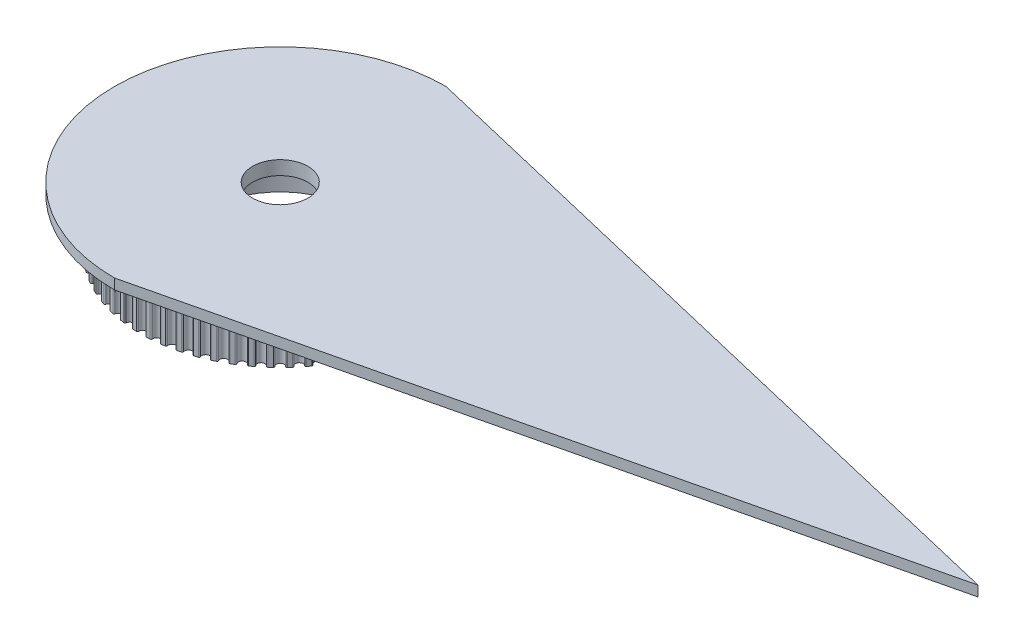
from build123d import *

# Parameters (mm, degrees)
BOSS_EXTRUDE1_DEPTH = 1.5
SKETCH2_R           = 11
BOSS_EXTRUDE3_DEPTH = 7.5
SKETCH3_R           = 6
SKETCH3_R_2         = 4
BOSS_EXTRUDE4_DEPTH = 0.5
SKETCH4_R           = 4
CUT_EXTRUDE1_DEPTH  = 105.082899652


with BuildPart() as part:
    # Sketch1 → Boss-Extrude1 (new body)
    with BuildSketch(Plane(origin=(0, 0, 0), x_dir=(1, 0, 0), z_dir=(0, 1, 0))):
        with BuildLine():
            Line((0, 24), (101, 0))
            Line((101, 0), (0, -24))
            ThreePointArc((0, -24), (-24, 0), (0, 24))
        make_face()
    extrude(amount=BOSS_EXTRUDE1_DEPTH)

    # Sketch2 → Boss-Extrude3 (add)
    with BuildSketch(Plane.XZ):
        with BuildLine():
            ThreePointArc((0, 19.37), (0.40140939, 19.54173051), (0.554407106, 19.950646841))
            ThreePointArc((0.554407106, 19.950646841), (0.597601495, 20.063061902), (0.709536651, 20.107485117))
            ThreePointArc((0.709536651, 20.107485117), (0.987241607, 20.095764579), (1.264758152, 20.080208834))
            ThreePointArc((1.264758152, 20.080208834), (1.371800073, 20.025027964), (1.403767866, 19.908920422))
            ThreePointArc((1.403767866, 19.908920422), (1.515948048, 19.486976737), (1.898592008, 19.276728156))
            ThreePointArc((1.898592008, 19.276728156), (2.314901036, 19.408286736), (2.507242836, 19.800237624))
            ThreePointArc((2.507242836, 19.800237624), (2.561247834, 19.907877585), (2.676998228, 19.941115327))
            ThreePointArc((2.676998228, 19.941115327), (2.952217146, 19.90223138), (3.226872643, 19.859549163))
            ThreePointArc((3.226872643, 19.859549163), (3.327990457, 19.794142061), (3.348423787, 19.675460217))
            ThreePointArc((3.348423787, 19.675460217), (3.418706077, 19.244552725), (3.778899537, 18.997810881))
            ThreePointArc((3.778899537, 18.997810881), (4.206098919, 19.087930551), (4.435932446, 19.459141295))
            ThreePointArc((4.435932446, 19.459141295), (4.500227957, 19.560969525), (4.61867885, 19.582701695))
            ThreePointArc((4.61867885, 19.582701695), (4.88876122, 19.517028814), (5.157910587, 19.447631177))
            ThreePointArc((5.157910587, 19.447631177), (5.252130474, 19.372627749), (5.260832557, 19.252514574))
            ThreePointArc((5.260832557, 19.252514574), (5.288540098, 18.81679315), (5.622814198, 18.535934303))
            ThreePointArc((5.622814198, 18.535934303), (6.05678977, 18.58374716), (6.321901602, 18.930642798))
            ThreePointArc((6.321901602, 18.930642798), (6.395868424, 19.025678635), (6.515879069, 19.035695941))
            ThreePointArc((6.515879069, 19.035695941), (6.77822385, 18.943866591), (7.039275031, 18.848421871))
            ThreePointArc((7.039275031, 18.848421871), (7.125689602, 18.764544442), (7.122576633, 18.644156691))
            ThreePointArc((7.122576633, 18.644156691), (7.107442587, 18.207817571), (7.412578085, 17.895546545))
            ThreePointArc((7.412578085, 17.895546545), (7.849150425, 17.900592125), (8.146987389, 18.219831862))
            ThreePointArc((8.146987389, 18.219831862), (8.229913182, 18.307160059), (8.35032781, 18.305366029))
            ThreePointArc((8.35032781, 18.305366029), (8.60240848, 18.188264578), (8.85284741, 18.067691959))
            ThreePointArc((8.85284741, 18.067691959), (8.930624445, 17.975748314), (8.915726402, 17.856245387))
            ThreePointArc((8.915726402, 17.856245387), (8.857896518, 17.423490756), (9.130954792, 17.08281489))
            ThreePointArc((9.130954792, 17.08281489), (9.565919471, 17.045044603), (9.893613234, 17.333553985))
            ThreePointArc((9.893613234, 17.333553985), (9.984699377, 17.412333524), (10.10435833, 17.398745436))
            ThreePointArc((10.10435833, 17.398745436), (10.343747213, 17.257499633), (10.581162028, 17.112960297))
            ThreePointArc((10.581162028, 17.112960297), (10.649552492, 17.013835903), (10.623012852, 16.896368679))
            ThreePointArc((10.623012852, 16.896368679), (10.523044063, 16.471366199), (10.761395414, 16.10556639))
            ThreePointArc((10.761395414, 16.10556639), (11.190563483, 16.025343983), (11.544958176, 16.280344508))
            ThreePointArc((11.544958176, 16.280344508), (11.643327459, 16.349816699), (11.761078356, 16.324565412))
            ThreePointArc((11.761078356, 16.324565412), (11.985470006, 16.160535533), (12.207574272, 15.993421473))
            ThreePointArc((12.207574272, 15.993421473), (12.265919528, 15.888070952), (12.227993882, 15.773770704))
            ThreePointArc((12.227993882, 15.773770704), (12.086848942, 15.360613382), (12.288197914, 14.973212482))
            ThreePointArc((12.288197914, 14.973212482), (12.707436251, 14.85131054), (13.085118859, 15.070346414))
            ThreePointArc((13.085118859, 15.070346414), (13.189823933, 15.129842201), (13.304532768, 15.0931709))
            ThreePointArc((13.304532768, 15.0931709), (13.511766172, 14.907936642), (13.716420902, 14.719857256))
            ThreePointArc((13.716420902, 14.719857256), (13.764159052, 14.609295192), (13.715212646, 14.499262694))
            ThreePointArc((13.715212646, 14.499262694), (13.534250858, 14.101929462), (13.696658352, 13.696658352))
            ThreePointArc((13.696658352, 13.696658352), (14.101929462, 13.534250858), (14.499262694, 13.715212646))
            ThreePointArc((14.499262694, 13.715212646), (14.609295192, 13.764159052), (14.719857256, 13.716420902))
            ThreePointArc((14.719857256, 13.716420902), (14.907936642, 13.511766172), (15.0931709, 13.304532768))
            ThreePointArc((15.0931709, 13.304532768), (15.129842201, 13.189823933), (15.070346414, 13.085118859))
            ThreePointArc((15.070346414, 13.085118859), (14.85131054, 12.707436251), (14.973212482, 12.288197914))
            ThreePointArc((14.973212482, 12.288197914), (15.360613382, 12.086848942), (15.773770704, 12.227993882))
            ThreePointArc((15.773770704, 12.227993882), (15.888070952, 12.265919528), (15.993421473, 12.207574272))
            ThreePointArc((15.993421473, 12.207574272), (16.160535533, 11.985470006), (16.324565412, 11.761078356))
            ThreePointArc((16.324565412, 11.761078356), (16.349816699, 11.643327459), (16.280344508, 11.544958176))
            ThreePointArc((16.280344508, 11.544958176), (16.025343983, 11.190563483), (16.10556639, 10.761395414))
            ThreePointArc((16.10556639, 10.761395414), (16.471366199, 10.523044063), (16.896368679, 10.623012852))
            ThreePointArc((16.896368679, 10.623012852), (17.013835903, 10.649552492), (17.112960297, 10.581162028))
            ThreePointArc((17.112960297, 10.581162028), (17.257499633, 10.343747213), (17.398745436, 10.10435833))
            ThreePointArc((17.398745436, 10.10435833), (17.412333524, 9.984699377), (17.333553985, 9.893613234))
            ThreePointArc((17.333553985, 9.893613234), (17.045044603, 9.565919471), (17.08281489, 9.130954792))
            ThreePointArc((17.08281489, 9.130954792), (17.423490756, 8.857896518), (17.856245387, 8.915726402))
            ThreePointArc((17.856245387, 8.915726402), (17.975748314, 8.930624445), (18.067691959, 8.85284741))
            ThreePointArc((18.067691959, 8.85284741), (18.188264578, 8.60240848), (18.305366029, 8.35032781))
            ThreePointArc((18.305366029, 8.35032781), (18.307160059, 8.229913182), (18.219831862, 8.146987389))
            ThreePointArc((18.219831862, 8.146987389), (17.900592125, 7.849150425), (17.895546545, 7.412578085))
            ThreePointArc((17.895546545, 7.412578085), (18.207817571, 7.107442587), (18.644156691, 7.122576633))
            ThreePointArc((18.644156691, 7.122576633), (18.764544442, 7.125689602), (18.848421871, 7.039275031))
            ThreePointArc((18.848421871, 7.039275031), (18.943866591, 6.77822385), (19.035695941, 6.515879069))
            ThreePointArc((19.035695941, 6.515879069), (19.025678635, 6.395868424), (18.930642798, 6.321901602))
            ThreePointArc((18.930642798, 6.321901602), (18.58374716, 6.05678977), (18.535934303, 5.622814198))
            ThreePointArc((18.535934303, 5.622814198), (18.81679315, 5.288540098), (19.252514574, 5.260832557))
            ThreePointArc((19.252514574, 5.260832557), (19.372627749, 5.252130474), (19.447631177, 5.157910587))
            ThreePointArc((19.447631177, 5.157910587), (19.517028814, 4.88876122), (19.582701695, 4.61867885))
            ThreePointArc((19.582701695, 4.61867885), (19.560969525, 4.500227957), (19.459141295, 4.435932446))
            ThreePointArc((19.459141295, 4.435932446), (19.087930551, 4.206098919), (18.997810881, 3.778899537))
            ThreePointArc((18.997810881, 3.778899537), (19.244552725, 3.418706077), (19.675460217, 3.348423787))
            ThreePointArc((19.675460217, 3.348423787), (19.794142061, 3.327990457), (19.859549163, 3.226872643))
            ThreePointArc((19.859549163, 3.226872643), (19.90223138, 2.952217146), (19.941115327, 2.676998228))
            ThreePointArc((19.941115327, 2.676998228), (19.907877585, 2.561247834), (19.800237624, 2.507242836))
            ThreePointArc((19.800237624, 2.507242836), (19.408286736, 2.314901036), (19.276728156, 1.898592008))
            ThreePointArc((19.276728156, 1.898592008), (19.486976737, 1.515948048), (19.908920422, 1.403767866))
            ThreePointArc((19.908920422, 1.403767866), (20.025027964, 1.371800073), (20.080208834, 1.264758152))
            ThreePointArc((20.080208834, 1.264758152), (20.095764579, 0.987241607), (20.107485117, 0.709536651))
            ThreePointArc((20.107485117, 0.709536651), (20.063061902, 0.597601495), (19.950646841, 0.554407106))
            ThreePointArc((19.950646841, 0.554407106), (19.54173051, 0.40140939), (19.37, 0))
            ThreePointArc((19.37, 0), (19.54173051, -0.40140939), (19.950646841, -0.554407106))
            ThreePointArc((19.950646841, -0.554407106), (20.063061902, -0.597601495), (20.107485117, -0.709536651))
            ThreePointArc((20.107485117, -0.709536651), (20.095764579, -0.987241607), (20.080208834, -1.264758152))
            ThreePointArc((20.080208834, -1.264758152), (20.025027964, -1.371800073), (19.908920422, -1.403767866))
            ThreePointArc((19.908920422, -1.403767866), (19.486976737, -1.515948048), (19.276728156, -1.898592008))
            ThreePointArc((19.276728156, -1.898592008), (19.408286736, -2.314901036), (19.800237624, -2.507242836))
            ThreePointArc((19.800237624, -2.507242836), (19.907877585, -2.561247834), (19.941115327, -2.676998228))
            ThreePointArc((19.941115327, -2.676998228), (19.90223138, -2.952217146), (19.859549163, -3.226872643))
            ThreePointArc((19.859549163, -3.226872643), (19.794142061, -3.327990457), (19.675460217, -3.348423787))
            ThreePointArc((19.675460217, -3.348423787), (19.244552725, -3.418706077), (18.997810881, -3.778899537))
            ThreePointArc((18.997810881, -3.778899537), (19.087930551, -4.206098919), (19.459141295, -4.435932446))
            ThreePointArc((19.459141295, -4.435932446), (19.560969525, -4.500227957), (19.582701695, -4.61867885))
            ThreePointArc((19.582701695, -4.61867885), (19.517028814, -4.88876122), (19.447631177, -5.157910587))
            ThreePointArc((19.447631177, -5.157910587), (19.372627749, -5.252130474), (19.252514574, -5.260832557))
            ThreePointArc((19.252514574, -5.260832557), (18.81679315, -5.288540098), (18.535934303, -5.622814198))
            ThreePointArc((18.535934303, -5.622814198), (18.58374716, -6.05678977), (18.930642798, -6.321901602))
            ThreePointArc((18.930642798, -6.321901602), (19.025678635, -6.395868424), (19.035695941, -6.515879069))
            ThreePointArc((19.035695941, -6.515879069), (18.943866591, -6.77822385), (18.848421871, -7.039275031))
            ThreePointArc((18.848421871, -7.039275031), (18.764544442, -7.125689602), (18.644156691, -7.122576633))
            ThreePointArc((18.644156691, -7.122576633), (18.207817571, -7.107442587), (17.895546545, -7.412578085))
            ThreePointArc((17.895546545, -7.412578085), (17.900592125, -7.849150425), (18.219831862, -8.146987389))
            ThreePointArc((18.219831862, -8.146987389), (18.307160059, -8.229913182), (18.305366029, -8.35032781))
            ThreePointArc((18.305366029, -8.35032781), (18.188264578, -8.60240848), (18.067691959, -8.85284741))
            ThreePointArc((18.067691959, -8.85284741), (17.975748314, -8.930624445), (17.856245387, -8.915726402))
            ThreePointArc((17.856245387, -8.915726402), (17.423490756, -8.857896518), (17.08281489, -9.130954792))
            ThreePointArc((17.08281489, -9.130954792), (17.045044603, -9.565919471), (17.333553985, -9.893613234))
            ThreePointArc((17.333553985, -9.893613234), (17.412333524, -9.984699377), (17.398745436, -10.10435833))
            ThreePointArc((17.398745436, -10.10435833), (17.257499633, -10.343747213), (17.112960297, -10.581162028))
            ThreePointArc((17.112960297, -10.581162028), (17.013835903, -10.649552492), (16.896368679, -10.623012852))
            ThreePointArc((16.896368679, -10.623012852), (16.471366199, -10.523044063), (16.10556639, -10.761395414))
            ThreePointArc((16.10556639, -10.761395414), (16.025343983, -11.190563483), (16.280344508, -11.544958176))
            ThreePointArc((16.280344508, -11.544958176), (16.349816699, -11.643327459), (16.324565412, -11.761078356))
            ThreePointArc((16.324565412, -11.761078356), (16.160535533, -11.985470006), (15.993421473, -12.207574272))
            ThreePointArc((15.993421473, -12.207574272), (15.888070952, -12.265919528), (15.773770704, -12.227993882))
            ThreePointArc((15.773770704, -12.227993882), (15.360613382, -12.086848942), (14.973212482, -12.288197914))
            ThreePointArc((14.973212482, -12.288197914), (14.85131054, -12.707436251), (15.070346414, -13.085118859))
            ThreePointArc((15.070346414, -13.085118859), (15.129842201, -13.189823933), (15.0931709, -13.304532768))
            ThreePointArc((15.0931709, -13.304532768), (14.907936642, -13.511766172), (14.719857256, -13.716420902))
            ThreePointArc((14.719857256, -13.716420902), (14.609295192, -13.764159052), (14.499262694, -13.715212646))
            ThreePointArc((14.499262694, -13.715212646), (14.101929462, -13.534250858), (13.696658352, -13.696658352))
            ThreePointArc((13.696658352, -13.696658352), (13.534250858, -14.101929462), (13.715212646, -14.499262694))
            ThreePointArc((13.715212646, -14.499262694), (13.764159052, -14.609295192), (13.716420902, -14.719857256))
            ThreePointArc((13.716420902, -14.719857256), (13.511766172, -14.907936642), (13.304532768, -15.0931709))
            ThreePointArc((13.304532768, -15.0931709), (13.189823933, -15.129842201), (13.085118859, -15.070346414))
            ThreePointArc((13.085118859, -15.070346414), (12.707436251, -14.85131054), (12.288197914, -14.973212482))
            ThreePointArc((12.288197914, -14.973212482), (12.086848942, -15.360613382), (12.227993882, -15.773770704))
            ThreePointArc((12.227993882, -15.773770704), (12.265919528, -15.888070952), (12.207574272, -15.993421473))
            ThreePointArc((12.207574272, -15.993421473), (11.985470006, -16.160535533), (11.761078356, -16.324565412))
            ThreePointArc((11.761078356, -16.324565412), (11.643327459, -16.349816699), (11.544958176, -16.280344508))
            ThreePointArc((11.544958176, -16.280344508), (11.190563483, -16.025343983), (10.761395414, -16.10556639))
            ThreePointArc((10.761395414, -16.10556639), (10.523044063, -16.471366199), (10.623012852, -16.896368679))
            ThreePointArc((10.623012852, -16.896368679), (10.649552492, -17.013835903), (10.581162028, -17.112960297))
            ThreePointArc((10.581162028, -17.112960297), (10.343747213, -17.257499633), (10.10435833, -17.398745436))
            ThreePointArc((10.10435833, -17.398745436), (9.984699377, -17.412333524), (9.893613234, -17.333553985))
            ThreePointArc((9.893613234, -17.333553985), (9.565919471, -17.045044603), (9.130954792, -17.08281489))
            ThreePointArc((9.130954792, -17.08281489), (8.857896518, -17.423490756), (8.915726402, -17.856245387))
            ThreePointArc((8.915726402, -17.856245387), (8.930624445, -17.975748314), (8.85284741, -18.067691959))
            ThreePointArc((8.85284741, -18.067691959), (8.60240848, -18.188264578), (8.35032781, -18.305366029))
            ThreePointArc((8.35032781, -18.305366029), (8.229913182, -18.307160059), (8.146987389, -18.219831862))
            ThreePointArc((8.146987389, -18.219831862), (7.849150425, -17.900592125), (7.412578085, -17.895546545))
            ThreePointArc((7.412578085, -17.895546545), (7.107442587, -18.207817571), (7.122576633, -18.644156691))
            ThreePointArc((7.122576633, -18.644156691), (7.125689602, -18.764544442), (7.039275031, -18.848421871))
            ThreePointArc((7.039275031, -18.848421871), (6.77822385, -18.943866591), (6.515879069, -19.035695941))
            ThreePointArc((6.515879069, -19.035695941), (6.395868424, -19.025678635), (6.321901602, -18.930642798))
            ThreePointArc((6.321901602, -18.930642798), (6.05678977, -18.58374716), (5.622814198, -18.535934303))
            ThreePointArc((5.622814198, -18.535934303), (5.288540098, -18.81679315), (5.260832557, -19.252514574))
            ThreePointArc((5.260832557, -19.252514574), (5.252130474, -19.372627749), (5.157910587, -19.447631177))
            ThreePointArc((5.157910587, -19.447631177), (4.88876122, -19.517028814), (4.61867885, -19.582701695))
            ThreePointArc((4.61867885, -19.582701695), (4.500227957, -19.560969525), (4.435932446, -19.459141295))
            ThreePointArc((4.435932446, -19.459141295), (4.206098919, -19.087930551), (3.778899537, -18.997810881))
            ThreePointArc((3.778899537, -18.997810881), (3.418706077, -19.244552725), (3.348423787, -19.675460217))
            ThreePointArc((3.348423787, -19.675460217), (3.327990457, -19.794142061), (3.226872643, -19.859549163))
            ThreePointArc((3.226872643, -19.859549163), (2.952217146, -19.90223138), (2.676998228, -19.941115327))
            ThreePointArc((2.676998228, -19.941115327), (2.561247834, -19.907877585), (2.507242836, -19.800237624))
            ThreePointArc((2.507242836, -19.800237624), (2.314901036, -19.408286736), (1.898592008, -19.276728156))
            ThreePointArc((1.898592008, -19.276728156), (1.515948048, -19.486976737), (1.403767866, -19.908920422))
            ThreePointArc((1.403767866, -19.908920422), (1.371800073, -20.025027964), (1.264758152, -20.080208834))
            ThreePointArc((1.264758152, -20.080208834), (0.987241607, -20.095764579), (0.709536651, -20.107485117))
            ThreePointArc((0.709536651, -20.107485117), (0.597601495, -20.063061902), (0.554407106, -19.950646841))
            ThreePointArc((0.554407106, -19.950646841), (0.40140939, -19.54173051), (0, -19.37))
            ThreePointArc((0, -19.37), (-0.40140939, -19.54173051), (-0.554407106, -19.950646841))
            ThreePointArc((-0.554407106, -19.950646841), (-0.597601495, -20.063061902), (-0.709536651, -20.107485117))
            ThreePointArc((-0.709536651, -20.107485117), (-0.987241607, -20.095764579), (-1.264758152, -20.080208834))
            ThreePointArc((-1.264758152, -20.080208834), (-1.371800073, -20.025027964), (-1.403767866, -19.908920422))
            ThreePointArc((-1.403767866, -19.908920422), (-1.515948048, -19.486976737), (-1.898592008, -19.276728156))
            ThreePointArc((-1.898592008, -19.276728156), (-2.314901036, -19.408286736), (-2.507242836, -19.800237624))
            ThreePointArc((-2.507242836, -19.800237624), (-2.561247834, -19.907877585), (-2.676998228, -19.941115327))
            ThreePointArc((-2.676998228, -19.941115327), (-2.952217146, -19.90223138), (-3.226872643, -19.859549163))
            ThreePointArc((-3.226872643, -19.859549163), (-3.327990457, -19.794142061), (-3.348423787, -19.675460217))
            ThreePointArc((-3.348423787, -19.675460217), (-3.418706077, -19.244552725), (-3.778899537, -18.997810881))
            ThreePointArc((-3.778899537, -18.997810881), (-4.206098919, -19.087930551), (-4.435932446, -19.459141295))
            ThreePointArc((-4.435932446, -19.459141295), (-4.500227957, -19.560969525), (-4.61867885, -19.582701695))
            ThreePointArc((-4.61867885, -19.582701695), (-4.88876122, -19.517028814), (-5.157910587, -19.447631177))
            ThreePointArc((-5.157910587, -19.447631177), (-5.252130474, -19.372627749), (-5.260832557, -19.252514574))
            ThreePointArc((-5.260832557, -19.252514574), (-5.288540098, -18.81679315), (-5.622814198, -18.535934303))
            ThreePointArc((-5.622814198, -18.535934303), (-6.05678977, -18.58374716), (-6.321901602, -18.930642798))
            ThreePointArc((-6.321901602, -18.930642798), (-6.395868424, -19.025678635), (-6.515879069, -19.035695941))
            ThreePointArc((-6.515879069, -19.035695941), (-6.77822385, -18.943866591), (-7.039275031, -18.848421871))
            ThreePointArc((-7.039275031, -18.848421871), (-7.125689602, -18.764544442), (-7.122576633, -18.644156691))
            ThreePointArc((-7.122576633, -18.644156691), (-7.107442587, -18.207817571), (-7.412578085, -17.895546545))
            ThreePointArc((-7.412578085, -17.895546545), (-7.849150425, -17.900592125), (-8.146987389, -18.219831862))
            ThreePointArc((-8.146987389, -18.219831862), (-8.229913182, -18.307160059), (-8.35032781, -18.305366029))
            ThreePointArc((-8.35032781, -18.305366029), (-8.60240848, -18.188264578), (-8.85284741, -18.067691959))
            ThreePointArc((-8.85284741, -18.067691959), (-8.930624445, -17.975748314), (-8.915726402, -17.856245387))
            ThreePointArc((-8.915726402, -17.856245387), (-8.857896518, -17.423490756), (-9.130954792, -17.08281489))
            ThreePointArc((-9.130954792, -17.08281489), (-9.565919471, -17.045044603), (-9.893613234, -17.333553985))
            ThreePointArc((-9.893613234, -17.333553985), (-9.984699377, -17.412333524), (-10.10435833, -17.398745436))
            ThreePointArc((-10.10435833, -17.398745436), (-10.343747213, -17.257499633), (-10.581162028, -17.112960297))
            ThreePointArc((-10.581162028, -17.112960297), (-10.649552492, -17.013835903), (-10.623012852, -16.896368679))
            ThreePointArc((-10.623012852, -16.896368679), (-10.523044063, -16.471366199), (-10.761395414, -16.10556639))
            ThreePointArc((-10.761395414, -16.10556639), (-11.190563483, -16.025343983), (-11.544958176, -16.280344508))
            ThreePointArc((-11.544958176, -16.280344508), (-11.643327459, -16.349816699), (-11.761078356, -16.324565412))
            ThreePointArc((-11.761078356, -16.324565412), (-11.985470006, -16.160535533), (-12.207574272, -15.993421473))
            ThreePointArc((-12.207574272, -15.993421473), (-12.265919528, -15.888070952), (-12.227993882, -15.773770704))
            ThreePointArc((-12.227993882, -15.773770704), (-12.086848942, -15.360613382), (-12.288197914, -14.973212482))
            ThreePointArc((-12.288197914, -14.973212482), (-12.707436251, -14.85131054), (-13.085118859, -15.070346414))
            ThreePointArc((-13.085118859, -15.070346414), (-13.189823933, -15.129842201), (-13.304532768, -15.0931709))
            ThreePointArc((-13.304532768, -15.0931709), (-13.511766172, -14.907936642), (-13.716420902, -14.719857256))
            ThreePointArc((-13.716420902, -14.719857256), (-13.764159052, -14.609295192), (-13.715212646, -14.499262694))
            ThreePointArc((-13.715212646, -14.499262694), (-13.534250858, -14.101929462), (-13.696658352, -13.696658352))
            ThreePointArc((-13.696658352, -13.696658352), (-14.101929462, -13.534250858), (-14.499262694, -13.715212646))
            ThreePointArc((-14.499262694, -13.715212646), (-14.609295192, -13.764159052), (-14.719857256, -13.716420902))
            ThreePointArc((-14.719857256, -13.716420902), (-14.907936642, -13.511766172), (-15.0931709, -13.304532768))
            ThreePointArc((-15.0931709, -13.304532768), (-15.129842201, -13.189823933), (-15.070346414, -13.085118859))
            ThreePointArc((-15.070346414, -13.085118859), (-14.85131054, -12.707436251), (-14.973212482, -12.288197914))
            ThreePointArc((-14.973212482, -12.288197914), (-15.360613382, -12.086848942), (-15.773770704, -12.227993882))
            ThreePointArc((-15.773770704, -12.227993882), (-15.888070952, -12.265919528), (-15.993421473, -12.207574272))
            ThreePointArc((-15.993421473, -12.207574272), (-16.160535533, -11.985470006), (-16.324565412, -11.761078356))
            ThreePointArc((-16.324565412, -11.761078356), (-16.349816699, -11.643327459), (-16.280344508, -11.544958176))
            ThreePointArc((-16.280344508, -11.544958176), (-16.025343983, -11.190563483), (-16.10556639, -10.761395414))
            ThreePointArc((-16.10556639, -10.761395414), (-16.471366199, -10.523044063), (-16.896368679, -10.623012852))
            ThreePointArc((-16.896368679, -10.623012852), (-17.013835903, -10.649552492), (-17.112960297, -10.581162028))
            ThreePointArc((-17.112960297, -10.581162028), (-17.257499633, -10.343747213), (-17.398745436, -10.10435833))
            ThreePointArc((-17.398745436, -10.10435833), (-17.412333524, -9.984699377), (-17.333553985, -9.893613234))
            ThreePointArc((-17.333553985, -9.893613234), (-17.045044603, -9.565919471), (-17.08281489, -9.130954792))
            ThreePointArc((-17.08281489, -9.130954792), (-17.423490756, -8.857896518), (-17.856245387, -8.915726402))
            ThreePointArc((-17.856245387, -8.915726402), (-17.975748314, -8.930624445), (-18.067691959, -8.85284741))
            ThreePointArc((-18.067691959, -8.85284741), (-18.188264578, -8.60240848), (-18.305366029, -8.35032781))
            ThreePointArc((-18.305366029, -8.35032781), (-18.307160059, -8.229913182), (-18.219831862, -8.146987389))
            ThreePointArc((-18.219831862, -8.146987389), (-17.900592125, -7.849150425), (-17.895546545, -7.412578085))
            ThreePointArc((-17.895546545, -7.412578085), (-18.207817571, -7.107442587), (-18.644156691, -7.122576633))
            ThreePointArc((-18.644156691, -7.122576633), (-18.764544442, -7.125689602), (-18.848421871, -7.039275031))
            ThreePointArc((-18.848421871, -7.039275031), (-18.943866591, -6.77822385), (-19.035695941, -6.515879069))
            ThreePointArc((-19.035695941, -6.515879069), (-19.025678635, -6.395868424), (-18.930642798, -6.321901602))
            ThreePointArc((-18.930642798, -6.321901602), (-18.58374716, -6.05678977), (-18.535934303, -5.622814198))
            ThreePointArc((-18.535934303, -5.622814198), (-18.81679315, -5.288540098), (-19.252514574, -5.260832557))
            ThreePointArc((-19.252514574, -5.260832557), (-19.372627749, -5.252130474), (-19.447631177, -5.157910587))
            ThreePointArc((-19.447631177, -5.157910587), (-19.517028814, -4.88876122), (-19.582701695, -4.61867885))
            ThreePointArc((-19.582701695, -4.61867885), (-19.560969525, -4.500227957), (-19.459141295, -4.435932446))
            ThreePointArc((-19.459141295, -4.435932446), (-19.087930551, -4.206098919), (-18.997810881, -3.778899537))
            ThreePointArc((-18.997810881, -3.778899537), (-19.244552725, -3.418706077), (-19.675460217, -3.348423787))
            ThreePointArc((-19.675460217, -3.348423787), (-19.794142061, -3.327990457), (-19.859549163, -3.226872643))
            ThreePointArc((-19.859549163, -3.226872643), (-19.90223138, -2.952217146), (-19.941115327, -2.676998228))
            ThreePointArc((-19.941115327, -2.676998228), (-19.907877585, -2.561247834), (-19.800237624, -2.507242836))
            ThreePointArc((-19.800237624, -2.507242836), (-19.408286736, -2.314901036), (-19.276728156, -1.898592008))
            ThreePointArc((-19.276728156, -1.898592008), (-19.486976737, -1.515948048), (-19.908920422, -1.403767866))
            ThreePointArc((-19.908920422, -1.403767866), (-20.025027964, -1.371800073), (-20.080208834, -1.264758152))
            ThreePointArc((-20.080208834, -1.264758152), (-20.095764579, -0.987241607), (-20.107485117, -0.709536651))
            ThreePointArc((-20.107485117, -0.709536651), (-20.063061902, -0.597601495), (-19.950646841, -0.554407106))
            ThreePointArc((-19.950646841, -0.554407106), (-19.54173051, -0.40140939), (-19.37, 0))
            ThreePointArc((-19.37, 0), (-19.54173051, 0.40140939), (-19.950646841, 0.554407106))
            ThreePointArc((-19.950646841, 0.554407106), (-20.063061902, 0.597601495), (-20.107485117, 0.709536651))
            ThreePointArc((-20.107485117, 0.709536651), (-20.095764579, 0.987241607), (-20.080208834, 1.264758152))
            ThreePointArc((-20.080208834, 1.264758152), (-20.025027964, 1.371800073), (-19.908920422, 1.403767866))
            ThreePointArc((-19.908920422, 1.403767866), (-19.486976737, 1.515948048), (-19.276728156, 1.898592008))
            ThreePointArc((-19.276728156, 1.898592008), (-19.408286736, 2.314901036), (-19.800237624, 2.507242836))
            ThreePointArc((-19.800237624, 2.507242836), (-19.907877585, 2.561247834), (-19.941115327, 2.676998228))
            ThreePointArc((-19.941115327, 2.676998228), (-19.90223138, 2.952217146), (-19.859549163, 3.226872643))
            ThreePointArc((-19.859549163, 3.226872643), (-19.794142061, 3.327990457), (-19.675460217, 3.348423787))
            ThreePointArc((-19.675460217, 3.348423787), (-19.244552725, 3.418706077), (-18.997810881, 3.778899537))
            ThreePointArc((-18.997810881, 3.778899537), (-19.087930551, 4.206098919), (-19.459141295, 4.435932446))
            ThreePointArc((-19.459141295, 4.435932446), (-19.560969525, 4.500227957), (-19.582701695, 4.61867885))
            ThreePointArc((-19.582701695, 4.61867885), (-19.517028814, 4.88876122), (-19.447631177, 5.157910587))
            ThreePointArc((-19.447631177, 5.157910587), (-19.372627749, 5.252130474), (-19.252514574, 5.260832557))
            ThreePointArc((-19.252514574, 5.260832557), (-18.81679315, 5.288540098), (-18.535934303, 5.622814198))
            ThreePointArc((-18.535934303, 5.622814198), (-18.58374716, 6.05678977), (-18.930642798, 6.321901602))
            ThreePointArc((-18.930642798, 6.321901602), (-19.025678635, 6.395868424), (-19.035695941, 6.515879069))
            ThreePointArc((-19.035695941, 6.515879069), (-18.943866591, 6.77822385), (-18.848421871, 7.039275031))
            ThreePointArc((-18.848421871, 7.039275031), (-18.764544442, 7.125689602), (-18.644156691, 7.122576633))
            ThreePointArc((-18.644156691, 7.122576633), (-18.207817571, 7.107442587), (-17.895546545, 7.412578085))
            ThreePointArc((-17.895546545, 7.412578085), (-17.900592125, 7.849150425), (-18.219831862, 8.146987389))
            ThreePointArc((-18.219831862, 8.146987389), (-18.307160059, 8.229913182), (-18.305366029, 8.35032781))
            ThreePointArc((-18.305366029, 8.35032781), (-18.188264578, 8.60240848), (-18.067691959, 8.85284741))
            ThreePointArc((-18.067691959, 8.85284741), (-17.975748314, 8.930624445), (-17.856245387, 8.915726402))
            ThreePointArc((-17.856245387, 8.915726402), (-17.423490756, 8.857896518), (-17.08281489, 9.130954792))
            ThreePointArc((-17.08281489, 9.130954792), (-17.045044603, 9.565919471), (-17.333553985, 9.893613234))
            ThreePointArc((-17.333553985, 9.893613234), (-17.412333524, 9.984699377), (-17.398745436, 10.10435833))
            ThreePointArc((-17.398745436, 10.10435833), (-17.257499633, 10.343747213), (-17.112960297, 10.581162028))
            ThreePointArc((-17.112960297, 10.581162028), (-17.013835903, 10.649552492), (-16.896368679, 10.623012852))
            ThreePointArc((-16.896368679, 10.623012852), (-16.471366199, 10.523044063), (-16.10556639, 10.761395414))
            ThreePointArc((-16.10556639, 10.761395414), (-16.025343983, 11.190563483), (-16.280344508, 11.544958176))
            ThreePointArc((-16.280344508, 11.544958176), (-16.349816699, 11.643327459), (-16.324565412, 11.761078356))
            ThreePointArc((-16.324565412, 11.761078356), (-16.160535533, 11.985470006), (-15.993421473, 12.207574272))
            ThreePointArc((-15.993421473, 12.207574272), (-15.888070952, 12.265919528), (-15.773770704, 12.227993882))
            ThreePointArc((-15.773770704, 12.227993882), (-15.360613382, 12.086848942), (-14.973212482, 12.288197914))
            ThreePointArc((-14.973212482, 12.288197914), (-14.85131054, 12.707436251), (-15.070346414, 13.085118859))
            ThreePointArc((-15.070346414, 13.085118859), (-15.129842201, 13.189823933), (-15.0931709, 13.304532768))
            ThreePointArc((-15.0931709, 13.304532768), (-14.907936642, 13.511766172), (-14.719857256, 13.716420902))
            ThreePointArc((-14.719857256, 13.716420902), (-14.609295192, 13.764159052), (-14.499262694, 13.715212646))
            ThreePointArc((-14.499262694, 13.715212646), (-14.101929462, 13.534250858), (-13.696658352, 13.696658352))
            ThreePointArc((-13.696658352, 13.696658352), (-13.534250858, 14.101929462), (-13.715212646, 14.499262694))
            ThreePointArc((-13.715212646, 14.499262694), (-13.764159052, 14.609295192), (-13.716420902, 14.719857256))
            ThreePointArc((-13.716420902, 14.719857256), (-13.511766172, 14.907936642), (-13.304532768, 15.0931709))
            ThreePointArc((-13.304532768, 15.0931709), (-13.189823933, 15.129842201), (-13.085118859, 15.070346414))
            ThreePointArc((-13.085118859, 15.070346414), (-12.707436251, 14.85131054), (-12.288197914, 14.973212482))
            ThreePointArc((-12.288197914, 14.973212482), (-12.086848942, 15.360613382), (-12.227993882, 15.773770704))
            ThreePointArc((-12.227993882, 15.773770704), (-12.265919528, 15.888070952), (-12.207574272, 15.993421473))
            ThreePointArc((-12.207574272, 15.993421473), (-11.985470006, 16.160535533), (-11.761078356, 16.324565412))
            ThreePointArc((-11.761078356, 16.324565412), (-11.643327459, 16.349816699), (-11.544958176, 16.280344508))
            ThreePointArc((-11.544958176, 16.280344508), (-11.190563483, 16.025343983), (-10.761395414, 16.10556639))
            ThreePointArc((-10.761395414, 16.10556639), (-10.523044063, 16.471366199), (-10.623012852, 16.896368679))
            ThreePointArc((-10.623012852, 16.896368679), (-10.649552492, 17.013835903), (-10.581162028, 17.112960297))
            ThreePointArc((-10.581162028, 17.112960297), (-10.343747213, 17.257499633), (-10.10435833, 17.398745436))
            ThreePointArc((-10.10435833, 17.398745436), (-9.984699377, 17.412333524), (-9.893613234, 17.333553985))
            ThreePointArc((-9.893613234, 17.333553985), (-9.565919471, 17.045044603), (-9.130954792, 17.08281489))
            ThreePointArc((-9.130954792, 17.08281489), (-8.857896518, 17.423490756), (-8.915726402, 17.856245387))
            ThreePointArc((-8.915726402, 17.856245387), (-8.930624445, 17.975748314), (-8.85284741, 18.067691959))
            ThreePointArc((-8.85284741, 18.067691959), (-8.60240848, 18.188264578), (-8.35032781, 18.305366029))
            ThreePointArc((-8.35032781, 18.305366029), (-8.229913182, 18.307160059), (-8.146987389, 18.219831862))
            ThreePointArc((-8.146987389, 18.219831862), (-7.849150425, 17.900592125), (-7.412578085, 17.895546545))
            ThreePointArc((-7.412578085, 17.895546545), (-7.107442587, 18.207817571), (-7.122576633, 18.644156691))
            ThreePointArc((-7.122576633, 18.644156691), (-7.125689602, 18.764544442), (-7.039275031, 18.848421871))
            ThreePointArc((-7.039275031, 18.848421871), (-6.77822385, 18.943866591), (-6.515879069, 19.035695941))
            ThreePointArc((-6.515879069, 19.035695941), (-6.395868424, 19.025678635), (-6.321901602, 18.930642798))
            ThreePointArc((-6.321901602, 18.930642798), (-6.05678977, 18.58374716), (-5.622814198, 18.535934303))
            ThreePointArc((-5.622814198, 18.535934303), (-5.288540098, 18.81679315), (-5.260832557, 19.252514574))
            ThreePointArc((-5.260832557, 19.252514574), (-5.252130474, 19.372627749), (-5.157910587, 19.447631177))
            ThreePointArc((-5.157910587, 19.447631177), (-4.88876122, 19.517028814), (-4.61867885, 19.582701695))
            ThreePointArc((-4.61867885, 19.582701695), (-4.500227957, 19.560969525), (-4.435932446, 19.459141295))
            ThreePointArc((-4.435932446, 19.459141295), (-4.206098919, 19.087930551), (-3.778899537, 18.997810881))
            ThreePointArc((-3.778899537, 18.997810881), (-3.418706077, 19.244552725), (-3.348423787, 19.675460217))
            ThreePointArc((-3.348423787, 19.675460217), (-3.327990457, 19.794142061), (-3.226872643, 19.859549163))
            ThreePointArc((-3.226872643, 19.859549163), (-2.952217146, 19.90223138), (-2.676998228, 19.941115327))
            ThreePointArc((-2.676998228, 19.941115327), (-2.561247834, 19.907877585), (-2.507242836, 19.800237624))
            ThreePointArc((-2.507242836, 19.800237624), (-2.314901036, 19.408286736), (-1.898592008, 19.276728156))
            ThreePointArc((-1.898592008, 19.276728156), (-1.515948048, 19.486976737), (-1.403767866, 19.908920422))
            ThreePointArc((-1.403767866, 19.908920422), (-1.371800073, 20.025027964), (-1.264758152, 20.080208834))
            ThreePointArc((-1.264758152, 20.080208834), (-0.987241607, 20.095764579), (-0.709536651, 20.107485117))
            ThreePointArc((-0.709536651, 20.107485117), (-0.597601495, 20.063061902), (-0.554407106, 19.950646841))
            ThreePointArc((-0.554407106, 19.950646841), (-0.40140939, 19.54173051), (0, 19.37))
        make_face()
        with Locations(Location((0, 0, 0), (0, 0, 270))):
            Circle(SKETCH2_R, mode=Mode.SUBTRACT)
    extrude(amount=BOSS_EXTRUDE3_DEPTH)

    # Sketch3 → Boss-Extrude4 (add)
    with BuildSketch(Plane.XZ):
        with Locations(Location((0, 0, 0), (0, 0, 90))):
            Circle(SKETCH3_R)
        with Locations(Location((0, 0, 0), (0, 0, 270))):
            Circle(SKETCH3_R_2, mode=Mode.SUBTRACT)
    extrude(amount=BOSS_EXTRUDE4_DEPTH)

    # Sketch4 → Cut-Extrude1 (cut, through all)
    with BuildSketch(Plane(origin=(0, 0, 0), x_dir=(-1, 0, 0), z_dir=(0, -1, 0))):
        with Locations(Location((0, 0, 0), (0, 0, 90))):
            Circle(SKETCH4_R)
    extrude(amount=-CUT_EXTRUDE1_DEPTH, mode=Mode.SUBTRACT)


solid = part.part
